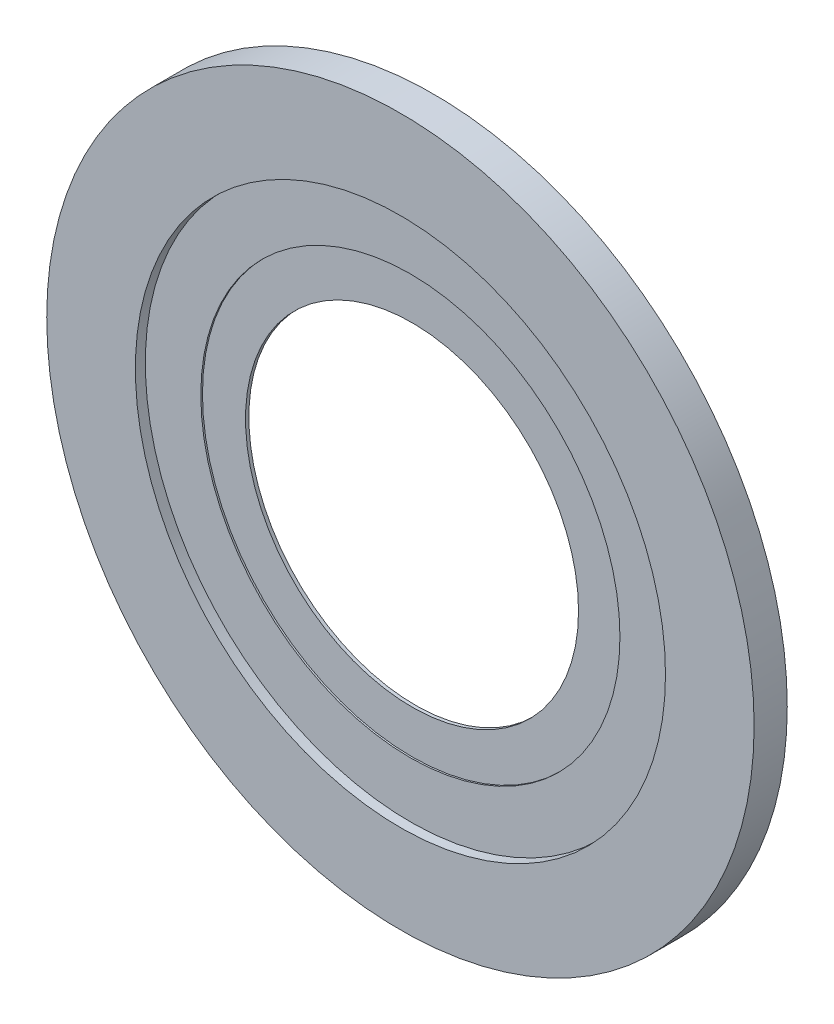
from build123d import *

# Parameters (mm, degrees)
SKIZZE2_R                       = 21.35
AUFSATZ_LINEAR_AUSTRAGEN1_DEPTH = 2
SKIZZE6_R                       = 10.05
SCHNITT_LINEAR_AUSTRAGEN4_DEPTH = 31.259626567
SKIZZE7_R                       = 16
SCHNITT_LINEAR_AUSTRAGEN5_DEPTH = 0.6
FASE1_SIZE                      = 1.1
FASE1_SIZE2                     = 6.238410002
SKIZZE8_R                       = 12.65
SCHNITT_LINEAR_AUSTRAGEN6_DEPTH = 0.1


with BuildPart() as part:
    # Skizze2 → Aufsatz-Linear austragen1 (new body)
    with BuildSketch(Plane.XY):
        Circle(SKIZZE2_R)
    extrude(amount=AUFSATZ_LINEAR_AUSTRAGEN1_DEPTH)

    # Skizze6 → Schnitt-Linear austragen4 (cut, through all)
    with BuildSketch(Plane.XY.offset(2)):
        Circle(SKIZZE6_R)
    extrude(amount=-SCHNITT_LINEAR_AUSTRAGEN4_DEPTH, mode=Mode.SUBTRACT)

    # Skizze7 → Schnitt-Linear austragen5 (cut)
    with BuildSketch(Plane.XY.offset(2)):
        Circle(SKIZZE7_R)
    extrude(amount=-SCHNITT_LINEAR_AUSTRAGEN5_DEPTH, mode=Mode.SUBTRACT)

    # Fase1
    fase1_edges = [part.edges().sort_by_distance(p)[0] for p in [
        (-10.05, 0, 0),
    ]]
    fase1_side = [part.faces().sort_by_distance(p)[0] for p in [
        (-10.05, 0, 0.7),
    ]]
    chamfer(fase1_edges, length=FASE1_SIZE, length2=FASE1_SIZE2, reference=fase1_side[0])

    # Skizze8 → Schnitt-Linear austragen6 (cut)
    with BuildSketch(Plane.XY.offset(1.4)):
        Circle(SKIZZE8_R)
    extrude(amount=-SCHNITT_LINEAR_AUSTRAGEN6_DEPTH, mode=Mode.SUBTRACT)


solid = part.part
